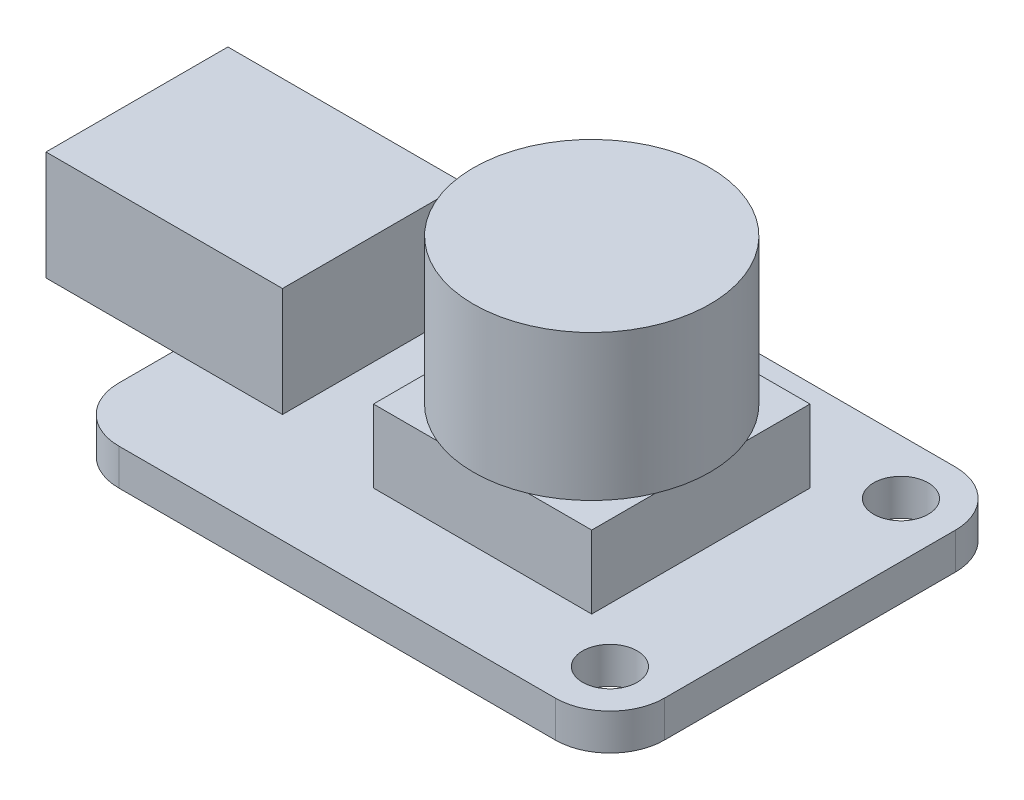
from build123d import *

# Parameters (mm, degrees)
SKETCH1_R           = 1.5
BOSS_EXTRUDE1_DEPTH = 2
SKETCH2_W           = 13
SKETCH2_H           = 10
BOSS_EXTRUDE2_DEPTH = 6
SKETCH4_W           = 12
SKETCH4_H           = 12
BOSS_EXTRUDE4_DEPTH = 4
SKETCH5_R           = 6.5
BOSS_EXTRUDE5_DEPTH = 8


with BuildPart() as part:
    # Sketch1 → Boss-Extrude1 (new body)
    with BuildSketch(Plane(origin=(0, 0, 0), x_dir=(1, 0, 0), z_dir=(0, 1, 0))):
        with BuildLine():
            Line((-12, 11), (12, 11))
            ThreePointArc((12, 11), (14.121320344, 10.121320344), (15, 8))
            Line((15, 8), (15, -8))
            ThreePointArc((15, -8), (14.121320344, -10.121320344), (12, -11))
            Line((12, -11), (-12, -11))
            ThreePointArc((-12, -11), (-14.121320344, -10.121320344), (-15, -8))
            Line((-15, -8), (-15, 8))
            ThreePointArc((-15, 8), (-14.121320344, 10.121320344), (-12, 11))
        make_face()
        with Locations(Location((12, 8, 0), (0, 0, 270))):
            Circle(SKETCH1_R, mode=Mode.SUBTRACT)
        with Locations(Location((12, -8, 0), (0, 0, 270))):
            Circle(SKETCH1_R, mode=Mode.SUBTRACT)
    extrude(amount=BOSS_EXTRUDE1_DEPTH)

    # Sketch2 → Boss-Extrude2 (add)
    with BuildSketch(Plane(origin=(0, 2, 0), x_dir=(1, 0, 0), z_dir=(0, 1, 0))):
        with Locations((-15.5, 0)):
            Rectangle(SKETCH2_W, SKETCH2_H)
    extrude(amount=BOSS_EXTRUDE2_DEPTH)

    # Sketch4 → Boss-Extrude4 (add)
    with BuildSketch(Plane(origin=(0, 2, 0), x_dir=(1, 0, 0), z_dir=(0, 1, 0))):
        with Locations((3, 0)):
            Rectangle(SKETCH4_W, SKETCH4_H)
    extrude(amount=BOSS_EXTRUDE4_DEPTH)

    # Sketch5 → Boss-Extrude5 (add)
    with BuildSketch(Plane(origin=(0, 6, 0), x_dir=(1, 0, 0), z_dir=(0, 1, 0))):
        with Locations(Location((3, 0, 0), (0, 0, 67.380135052))):
            Circle(SKETCH5_R)
    extrude(amount=BOSS_EXTRUDE5_DEPTH)


solid = part.part
